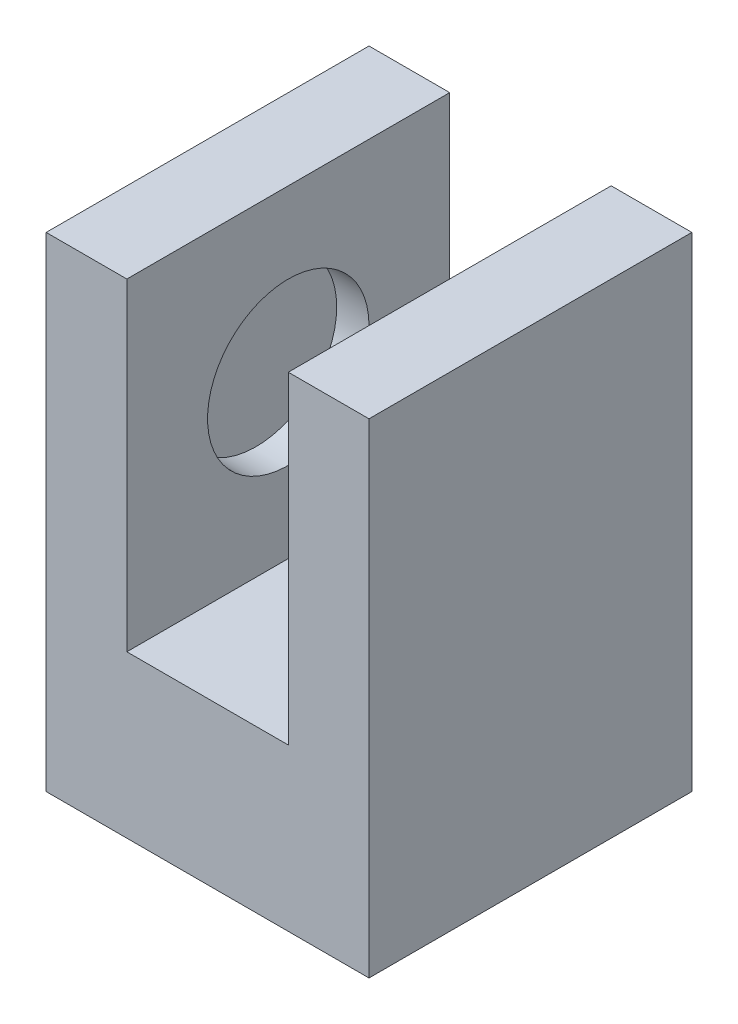
from build123d import *

# Parameters (mm, degrees)
EXTRUDE_1_DEPTH      = 50
EXTRUDE_1_DEPTH_BACK = 100
SKETCH_2_W           = 100
SKETCH_2_H           = 100
SKETCH_3_W           = 50
SKETCH_3_H           = 100
CUT_EXTRUDE_1_DEPTH  = 100
SKETCH_4_R           = 25
CUT_EXTRUDE_2_DEPTH  = 10
CUT_EXTRUDE_START    = -10
SKETCH_5_R           = 25
CUT_EXTRUDE_3_DEPTH  = 10


with BuildPart() as part:
    # 草图2 → 凸台-拉伸1 (new, two sides: drawn at the far end of the back side and taken through both)
    with BuildSketch(Plane(origin=(0, 0, 0), x_dir=(1, 0, 0), z_dir=(0, 1, 0)).offset(-EXTRUDE_1_DEPTH_BACK)):
        Rectangle(SKETCH_2_W, SKETCH_2_H)
    extrude(amount=EXTRUDE_1_DEPTH + EXTRUDE_1_DEPTH_BACK)

    # 草图3 → 切除-拉伸1 (cut)
    with BuildSketch(Plane(origin=(0, 50, 0), x_dir=(1, 0, 0), z_dir=(0, 1, 0))):
        Rectangle(SKETCH_3_W, SKETCH_3_H)
    extrude(amount=-CUT_EXTRUDE_1_DEPTH, mode=Mode.SUBTRACT)

    # 草图4 → 切除-拉伸2 (cut)
    with BuildSketch(Plane(origin=(-25, 0, 0), x_dir=(0, 0, -1), z_dir=(1, 0, 0))):
        Circle(SKETCH_4_R)
    extrude(amount=-CUT_EXTRUDE_2_DEPTH, mode=Mode.SUBTRACT)

    # 草图5 → 切除-拉伸3 (cut)
    with BuildSketch(Plane.ZY.offset(-25).offset(CUT_EXTRUDE_START)):
        with Locations(Location((0, 0, 0), (0, 0, 180))):
            Circle(SKETCH_5_R)
    extrude(amount=CUT_EXTRUDE_3_DEPTH, mode=Mode.SUBTRACT)


solid = part.part
